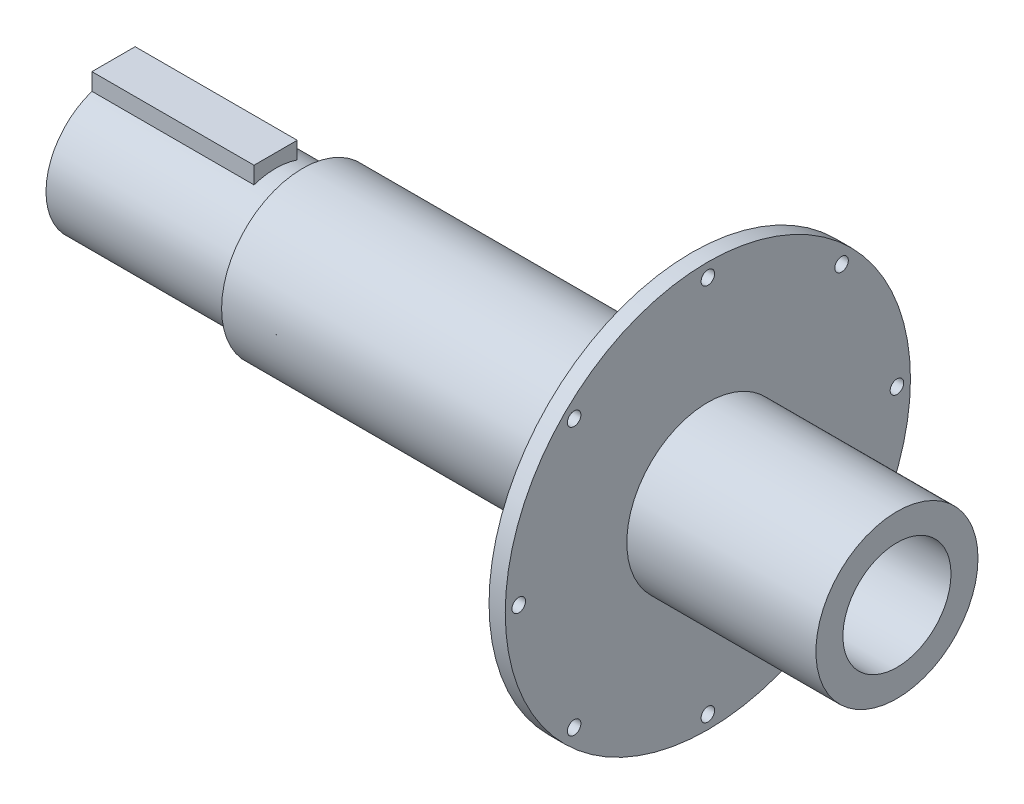
from build123d import *

# Parameters (mm, degrees)
SKETCH1_R                   = 25
SKETCH1_R_2                 = 10
BOSS_EXTRUDE1_DEPTH         = 3
BOSS_EXTRUDE2_DEPTH         = 35
BOSS_EXTRUDE2_DEPTH_BACK    = 110
SKETCH1_3_R                 = 15
SKETCH1_3_R_2               = 10
SKETCH1_4_R                 = 37.5
SKETCH1_4_R_2               = 25
BOSS_EXTRUDE3_DEPTH         = 3
M3_TAPPED_HOLE1_D           = 2.5
M3_TAPPED_HOLE1_CSINK_D     = 3.05
M3_TAPPED_HOLE1_CSINK_ANGLE = 90
SKETCH4_R                   = 20
SKETCH4_R_2                 = 12.5
CUT_EXTRUDE1_DEPTH          = 35
BOSS_EXTRUDE4_DEPTH         = 30


with BuildPart() as part:
    # Sketch1 → Boss-Extrude1 (new body)
    with BuildSketch(Plane(origin=(0, 0, 0), x_dir=(0, 0, -1), z_dir=(1, 0, 0))):
        Circle(SKETCH1_R)
        Circle(SKETCH1_R_2, mode=Mode.SUBTRACT)
    extrude(amount=-BOSS_EXTRUDE1_DEPTH)



with BuildPart() as body_2:
    # Sketch1<3> → Boss-Extrude2 (new, two sides: drawn at the far end of the back side and taken through both)
    with BuildSketch(Plane(origin=(0, 0, 0), x_dir=(0, 0, -1), z_dir=(1, 0, 0)).offset(-BOSS_EXTRUDE2_DEPTH_BACK)):
        Circle(SKETCH1_3_R)
        Circle(SKETCH1_3_R_2, mode=Mode.SUBTRACT)
    extrude(amount=BOSS_EXTRUDE2_DEPTH + BOSS_EXTRUDE2_DEPTH_BACK)


with BuildPart() as part_1:
    add(part.part)

    add(body_2.part)  # Boss-Extrude3 merges body 2
    # Sketch1<4> → Boss-Extrude3 (add)
    with BuildSketch(Plane(origin=(0, 0, 0), x_dir=(0, 0, -1), z_dir=(1, 0, 0))):
        Circle(SKETCH1_4_R)
        Circle(SKETCH1_4_R_2, mode=Mode.SUBTRACT)
    extrude(amount=-BOSS_EXTRUDE3_DEPTH)

    # M3 Tapped Hole1 (through all)
    with Locations(Plane.ZY.offset(3)):
        with Locations((35, 0), (0, 35), (-35, 0), (0, -35), (24.748737342, 24.748737342), (-24.748737342, 24.748737342), (-24.748737342, -24.748737342), (24.748737342, -24.748737342)):
            CounterSinkHole(M3_TAPPED_HOLE1_D / 2, M3_TAPPED_HOLE1_CSINK_D / 2, counter_sink_angle=M3_TAPPED_HOLE1_CSINK_ANGLE)

    # Sketch4 → Cut-Extrude1 (cut)
    with BuildSketch(Plane.ZY.offset(110)):
        Circle(SKETCH4_R)
        Circle(SKETCH4_R_2, mode=Mode.SUBTRACT)
    extrude(amount=-CUT_EXTRUDE1_DEPTH, mode=Mode.SUBTRACT)

    # Sketch4<3> → Boss-Extrude4 (add)
    with BuildSketch(Plane.ZY.offset(110)):
        with BuildLine():
            Line((4, 15), (-4, 15))
            Line((-4, 15), (-4, 11.842719282))
            ThreePointArc((-4, 11.842719282), (0, -12.5), (4, 11.842719282))
            Line((4, 11.842719282), (4, 15))
        make_face()
    extrude(amount=-BOSS_EXTRUDE4_DEPTH)


solid = part_1.part
